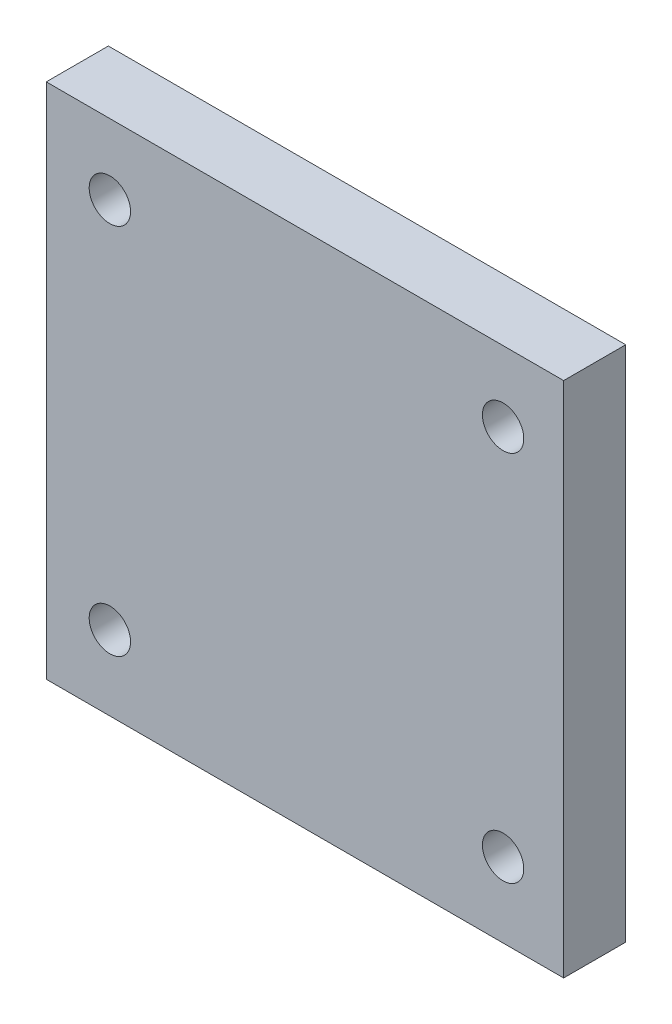
from build123d import *

# Parameters (mm, degrees)
ESQUISSE1_W        = 25
ESQUISSE1_H        = 25
ESQUISSE1_R        = 1
BOSS_EXTRU_1_DEPTH = 3


with BuildPart() as part:
    # Esquisse1 → Boss.-Extru.1 (new body)
    with BuildSketch(Plane.XY):
        with Locations((-1.315129748, -0.313430953)):
            Rectangle(ESQUISSE1_W, ESQUISSE1_H)
        with Locations(Location((-10.74158344, -9.209614493, 0), (0, 0, 180))):
            Circle(ESQUISSE1_R, mode=Mode.SUBTRACT)
        with Locations(Location((-10.74158344, 8.790385507, 0), (0, 0, 180))):
            Circle(ESQUISSE1_R, mode=Mode.SUBTRACT)
        with Locations(Location((8.25841656, -9.209614493, 0), (0, 0, 180))):
            Circle(ESQUISSE1_R, mode=Mode.SUBTRACT)
        with Locations(Location((8.25841656, 8.790385507, 0), (0, 0, 180))):
            Circle(ESQUISSE1_R, mode=Mode.SUBTRACT)
    extrude(amount=BOSS_EXTRU_1_DEPTH)


solid = part.part
